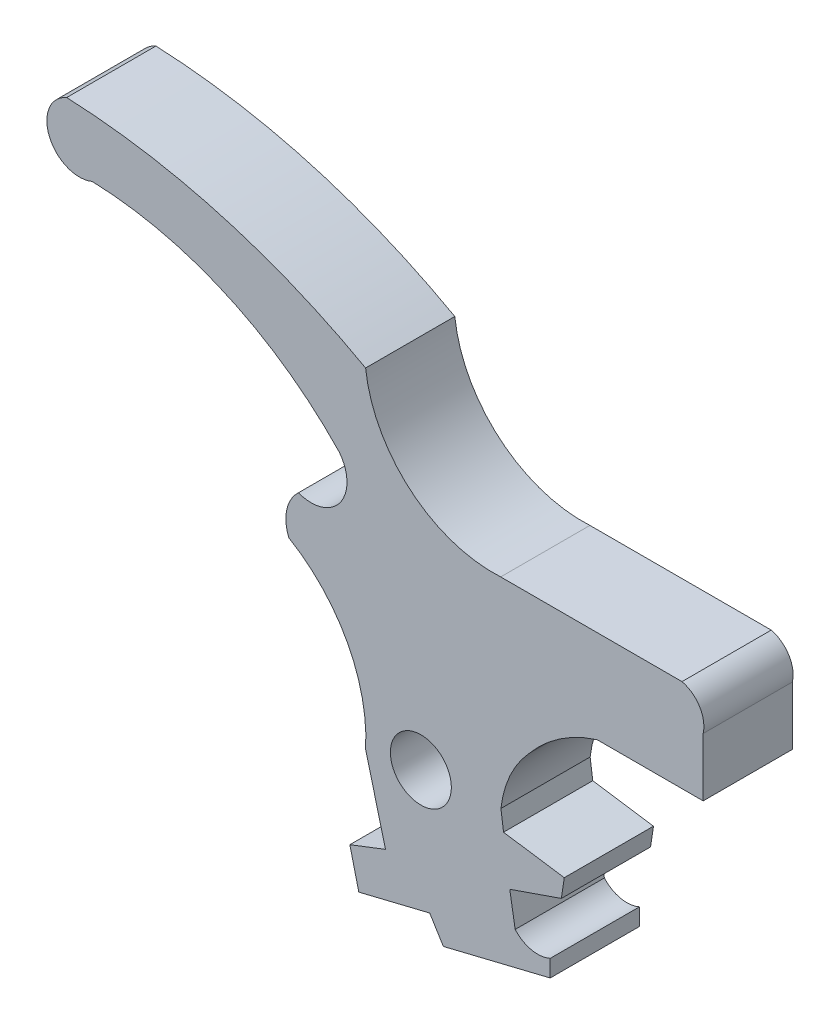
from build123d import *

# Parameters (mm, degrees)
SKETCH_1_R      = 2.05
EXTRUDE_1_DEPTH = 3


with BuildPart() as part:
    # 스케치1 → 보스-돌출1 (new, symmetric)
    with BuildSketch(Plane.XY):
        with BuildLine():
            Line((-3.714453644, -0.659762387), (-2.378622648, -5.81789167))
            Line((-2.378622648, -5.81789167), (-4.775045742, -6.743825318))
            Line((-4.775045742, -6.743825318), (-4.17347403, -9.205553558))
            Line((-4.17347403, -9.205553558), (0.595403586, -8.040184518))
            Line((0.595403586, -8.040184518), (1.5135427, -9.526878273))
            Line((1.5135427, -9.526878273), (8.699439255, -7.770863118))
            Line((8.699439255, -7.770863118), (8.699439255, -6.62630488))
            ThreePointArc((8.699439255, -6.62630488), (7.437294697, -6.763917269), (6.342454802, -6.121055183))
            Line((6.342454802, -6.121055183), (5.976753085, -3.963411438))
            Line((5.976753085, -3.963411438), (9.448395839, -2.762750085))
            Line((9.448395839, -2.762750085), (9.643145165, -1.456614425))
            Line((9.643145165, -1.456614425), (5.558763062, -0.851575902))
            Line((5.558763062, -0.851575902), (5.384598497, 0.445037535))
            ThreePointArc((5.384598497, 0.445037535), (6.001978603, 2.68132709), (7.290465917, 4.61056259))
            ThreePointArc((7.290465917, 4.61056259), (9.349741981, 6.480399593), (11.856878684, 7.685046382))
            Line((11.856878684, 7.685046382), (18.984206684, 7.685046382))
            Line((18.984206684, 7.685046382), (18.984206684, 11.608441399))
            ThreePointArc((18.984206684, 11.608441399), (18.747143867, 13.056663145), (17.562507461, 13.922793382))
            Line((17.562507461, 13.922793382), (5.368815069, 13.922793382))
            ThreePointArc((5.368815069, 13.922793382), (-0.689207057, 15.930226431), (-3.717586974, 21.547906968))
            ThreePointArc((-3.717586974, 21.547906968), (-13.434946181, 25.571091327), (-23.817349178, 27.25001668))
            ThreePointArc((-23.817349178, 27.25001668), (-24.977134733, 24.378166735), (-22.105284788, 23.21838118))
            ThreePointArc((-22.105284788, 23.21838118), (-13.06126812, 21.129967821), (-5.487273706, 15.764306963))
            ThreePointArc((-5.487273706, 15.764306963), (-5.434873097, 12.848146862), (-8.232673416, 12.024102607))
            ThreePointArc((-8.232673416, 12.024102607), (-9.017409998, 10.65199102), (-8.87513846, 9.077741828))
            ThreePointArc((-8.87513846, 9.077741828), (-4.931237162, 4.931648988), (-3.714453644, -0.659762387))
        make_face()
        Circle(SKETCH_1_R, mode=Mode.SUBTRACT)
    extrude(amount=EXTRUDE_1_DEPTH, both=True)


solid = part.part
